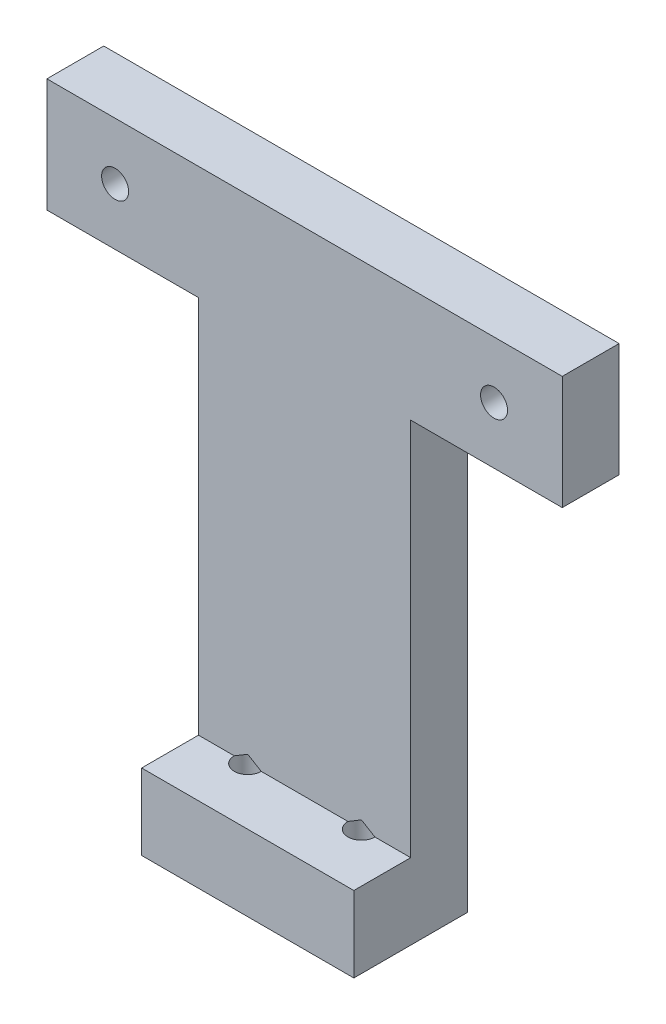
from build123d import *

# Parameters (mm, degrees)
SKETCH1_W                 = 17.78
SKETCH1_H                 = 9.525
BOSS_EXTRUDE1_DEPTH       = 47.625
SKETCH2_W                 = 17.78
SKETCH2_H                 = 4.7625
CUT_EXTRUDE1_DEPTH        = 41.275
F_4_40_TAPPED_HOLE1_D     = 2.2606
F_4_40_TAPPED_HOLE1_DEPTH = 6.35
F_4_40_TAPPED_HOLE1_TIP   = 0.679152758
SKETCH9_W                 = 4.7625
SKETCH9_H                 = 9.525
BOSS_EXTRUDE2_DEPTH       = 12.7
SKETCH10_R                = 1.1303
CUT_EXTRUDE3_DEPTH        = 53.506667493


with BuildPart() as part:
    # Sketch1 → Boss-Extrude1 (new body)
    with BuildSketch(Plane(origin=(0, 0, 0), x_dir=(1, 0, 0), z_dir=(0, 1, 0))):
        Rectangle(SKETCH1_W, SKETCH1_H)
    extrude(amount=BOSS_EXTRUDE1_DEPTH)

    # Sketch2 → Cut-Extrude1 (cut)
    with BuildSketch(Plane(origin=(0, 47.625, 0), x_dir=(1, 0, 0), z_dir=(0, 1, 0))):
        with Locations((0, -2.38125)):
            Rectangle(SKETCH2_W, SKETCH2_H)
    extrude(amount=-CUT_EXTRUDE1_DEPTH, mode=Mode.SUBTRACT)

    # #4-40 Tapped Hole1
    with Locations(Plane(origin=(0, 0, 0), x_dir=(-1, 0, 0), z_dir=(0, -1, 0))):
        with Locations((-4.7625, 0), (4.7625, 0)):
            Hole(F_4_40_TAPPED_HOLE1_D / 2, depth=F_4_40_TAPPED_HOLE1_DEPTH)
            with Locations((0, 0, -(F_4_40_TAPPED_HOLE1_DEPTH + F_4_40_TAPPED_HOLE1_TIP / 2))):  # 118° drill point
                Cone(0, F_4_40_TAPPED_HOLE1_D / 2, F_4_40_TAPPED_HOLE1_TIP, mode=Mode.SUBTRACT)

    # Sketch9 → Boss-Extrude2 (add)
    with BuildSketch(Plane.ZY.offset(8.89)):
        with Locations((-2.38125, 42.8625)):
            Rectangle(SKETCH9_W, SKETCH9_H)
    boss_extrude2 = extrude(amount=BOSS_EXTRUDE2_DEPTH)

    # Mirror1: Boss-Extrude2 across plane
    add(boss_extrude2.mirror(Plane(origin=(0, 0, 0), x_dir=(0, 0, 1), z_dir=(1, 0, 0))))

    # Sketch10 → Cut-Extrude3 (cut, through all)
    with BuildSketch(Plane.XY):
        with Locations((-15.875, 42.8625)):
            Circle(SKETCH10_R)
        with Locations((15.875, 42.8625)):
            Circle(SKETCH10_R)
    extrude(amount=-CUT_EXTRUDE3_DEPTH, mode=Mode.SUBTRACT)


solid = part.part
